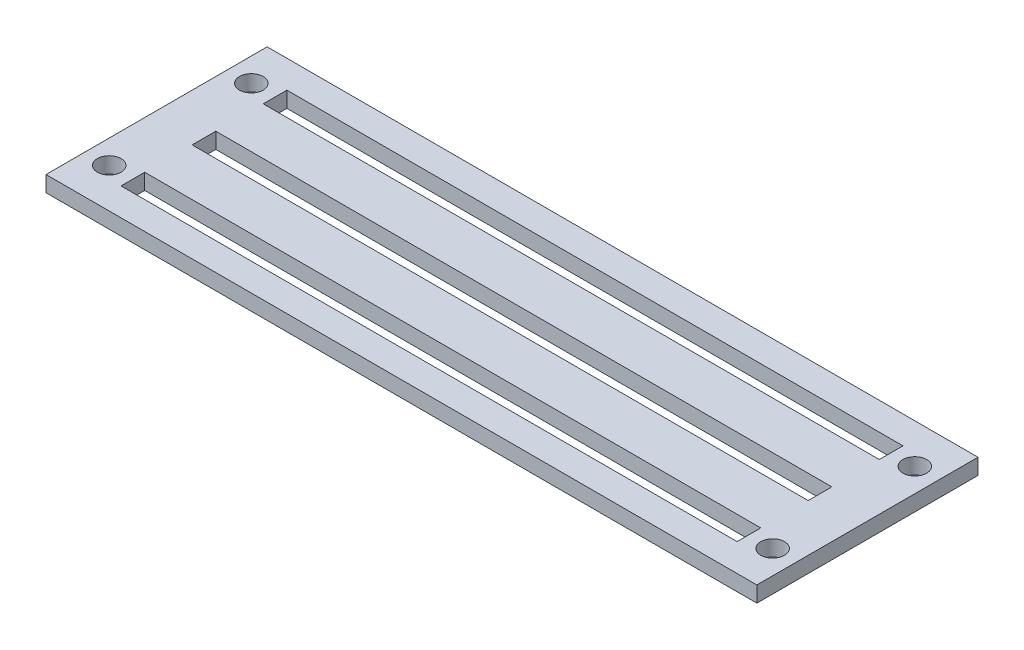
from build123d import *

# Parameters (mm, degrees)
SKETCH1_W           = 90
SKETCH1_H           = 28
BOSS_EXTRUDE1_DEPTH = 2
SKETCH2_R           = 1.5
SKETCH2_W           = 78
SKETCH2_H           = 3
CUT_EXTRUDE1_DEPTH  = 95.276189995


with BuildPart() as part:
    # Sketch1 → Boss-Extrude1 (new body)
    with BuildSketch(Plane(origin=(0, 0, 0), x_dir=(1, 0, 0), z_dir=(0, 1, 0))):
        with Locations((45, 14)):
            Rectangle(SKETCH1_W, SKETCH1_H)
    extrude(amount=BOSS_EXTRUDE1_DEPTH)

    # Sketch2 → Cut-Extrude1 (cut, through all)
    with BuildSketch(Plane(origin=(0, 2, 0), x_dir=(1, 0, 0), z_dir=(0, 1, 0))):
        with Locations(Location((3, 23, 0), (0, 0, 270))):
            Circle(SKETCH2_R)
        with Locations(Location((3, 5, 0), (0, 0, 270))):
            Circle(SKETCH2_R)
        with Locations(Location((87, 23, 0), (0, 0, 270))):
            Circle(SKETCH2_R)
        with Locations(Location((87, 5, 0), (0, 0, 270))):
            Circle(SKETCH2_R)
        with Locations((45, 14)):
            Rectangle(SKETCH2_W, SKETCH2_H)
        with Locations((45, 5)):
            Rectangle(SKETCH2_W, SKETCH2_H)
        with Locations((45, 23)):
            Rectangle(SKETCH2_W, SKETCH2_H)
    extrude(amount=-CUT_EXTRUDE1_DEPTH, mode=Mode.SUBTRACT)


solid = part.part
